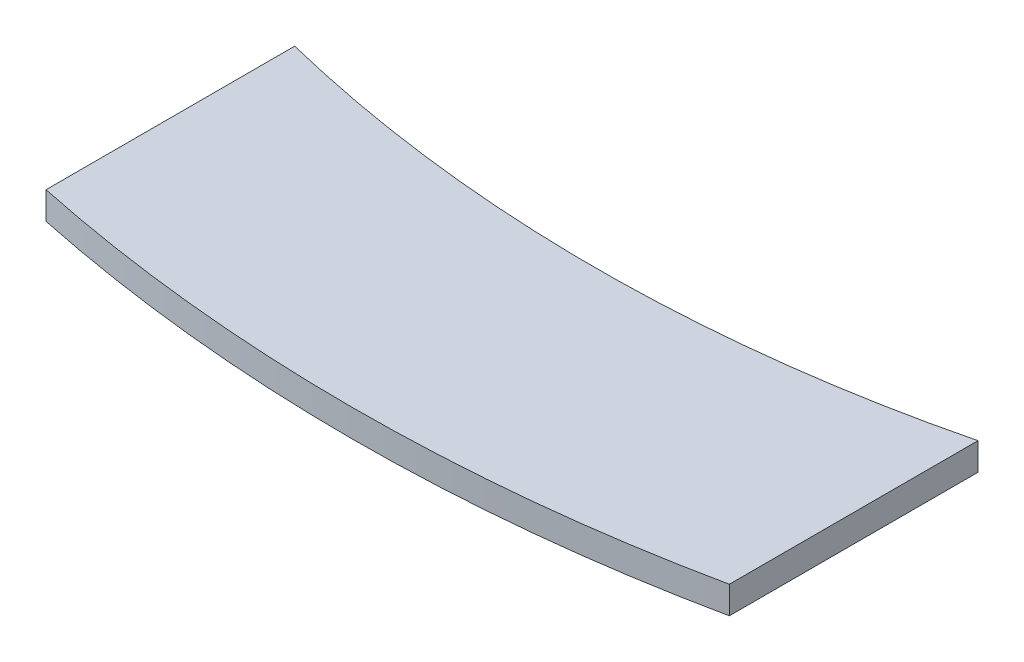
from build123d import *

# Parameters (mm, degrees)
BOSS_EXTRUDE1_DEPTH = 1.016


with BuildPart() as part:
    # Sketch1 → Boss-Extrude1 (new body)
    with BuildSketch(Plane(origin=(0, 0, 0), x_dir=(1, 0, 0), z_dir=(0, 1, 0))):
        with BuildLine():
            Line((-12.682, 5.272259856), (-12.682, -3.95785129))
            ThreePointArc((-12.682, -3.95785129), (0, -5.272259856), (12.682, -3.95785129))
            Line((12.682, -3.95785129), (12.682, 5.272259856))
            ThreePointArc((12.682, 5.272259856), (0, 3.727740144), (-12.682, 5.272259856))
        make_face()
    extrude(amount=BOSS_EXTRUDE1_DEPTH)


solid = part.part
